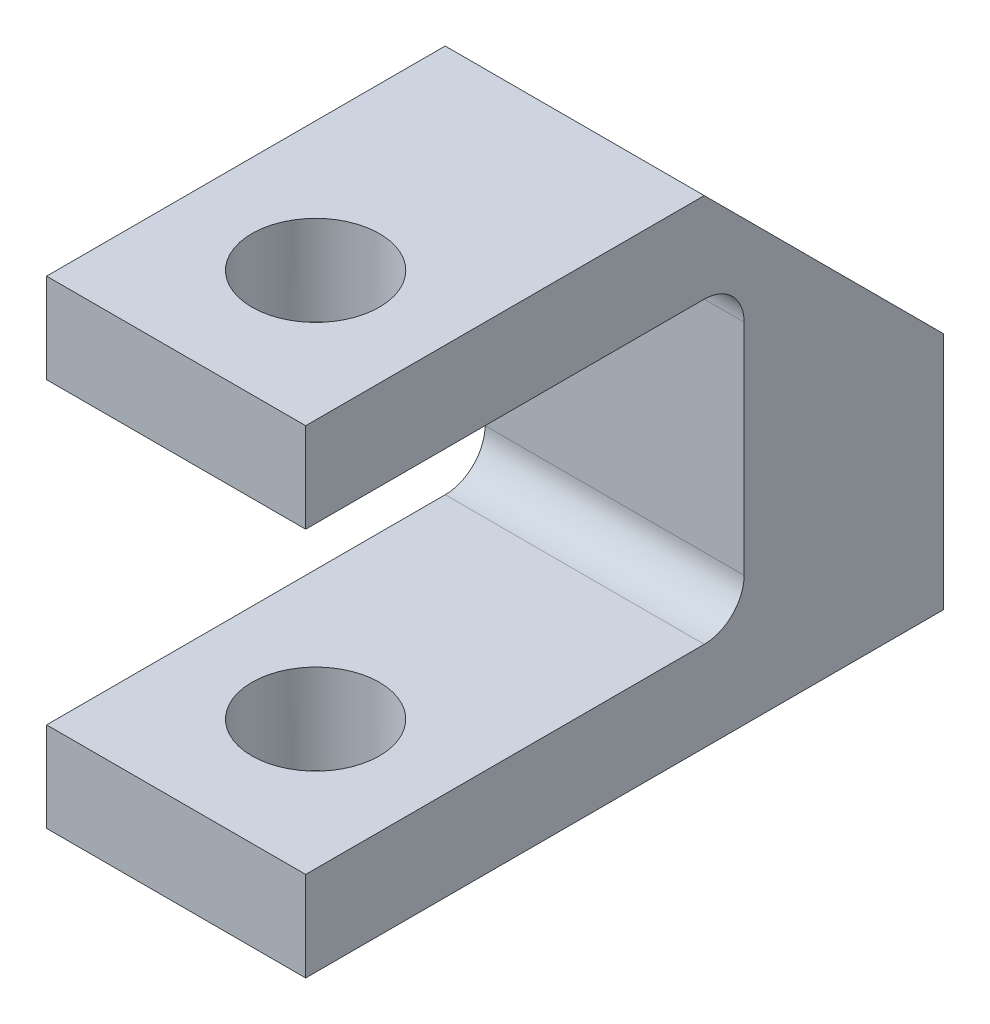
from build123d import *

# Parameters (mm, degrees)
SKETCH1_W           = 16
SKETCH1_H           = 12
BOSS_EXTRUDE1_DEPTH = 6.5
CUT_EXTRUDE1_DEPTH  = 12.926860442
SKETCH3_W           = 14
SKETCH3_H           = 7.5
CUT_EXTRUDE2_DEPTH  = 11
SKETCH4_R           = 1.6
CUT_EXTRUDE3_DEPTH  = 16.81929202
FILLET1_R           = 1


with BuildPart() as part:
    # Sketch1 → Boss-Extrude1 (new body)
    with BuildSketch(Plane(origin=(0, 0, 0), x_dir=(0, 0, -1), z_dir=(1, 0, 0))):
        Rectangle(SKETCH1_W, SKETCH1_H)
    extrude(amount=-BOSS_EXTRUDE1_DEPTH)

    # Sketch2 → Cut-Extrude1 (cut, through all)
    with BuildSketch(Plane(origin=(0, 0, 0), x_dir=(0, 0, -1), z_dir=(1, 0, 0))):
        Polygon((8, 0), (2, 6), (8, 6), align=None)
    extrude(amount=-CUT_EXTRUDE1_DEPTH, mode=Mode.SUBTRACT)

    # Sketch3 → Cut-Extrude2 (cut)
    with BuildSketch(Plane.XY.offset(8)):
        with Locations((-3.25, 0)):
            Rectangle(SKETCH3_W, SKETCH3_H)
    extrude(amount=-CUT_EXTRUDE2_DEPTH, mode=Mode.SUBTRACT)

    # Sketch4 → Cut-Extrude3 (cut, through all)
    with BuildSketch(Plane(origin=(0, 6, 0), x_dir=(1, 0, 0), z_dir=(0, 1, 0))):
        with Locations(Location((-3.25, -4.5, 0), (0, 0, 270))):
            Circle(SKETCH4_R)
    extrude(amount=-CUT_EXTRUDE3_DEPTH, mode=Mode.SUBTRACT)

    # Fillet1
    fillet1_edges = [part.edges().sort_by_distance(p)[0] for p in [
        (-3.25, -3.75, -3),
        (-3.25, 3.75, -3),
    ]]
    fillet(fillet1_edges, radius=FILLET1_R)


solid = part.part
